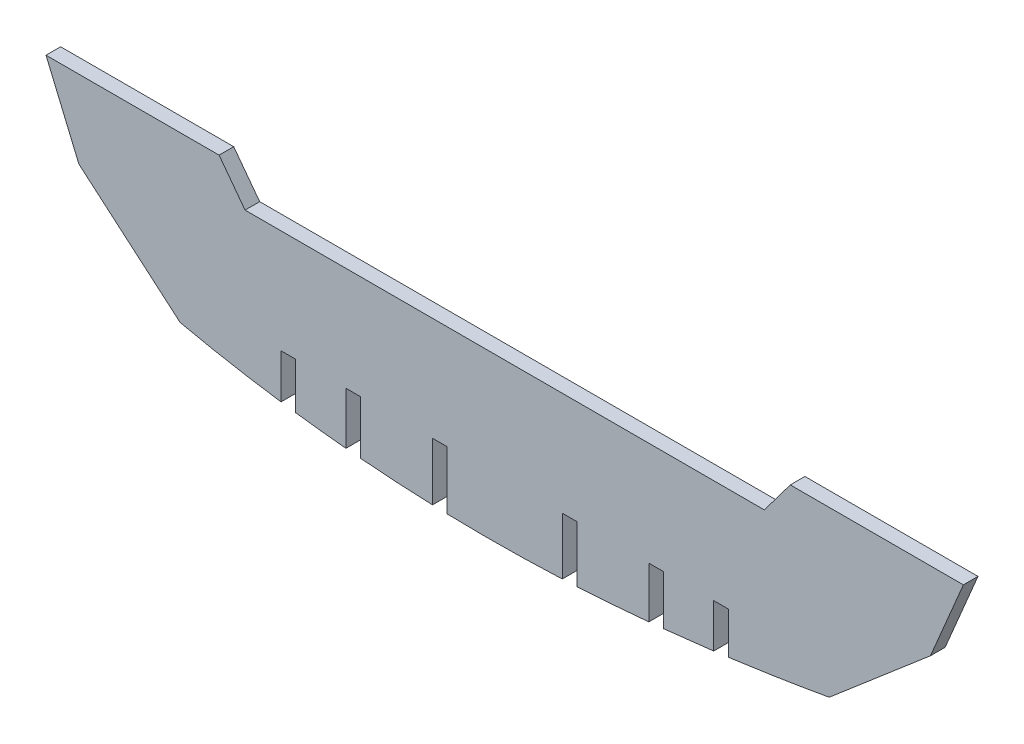
from build123d import *

# Parameters (mm, degrees)
SKETCH1_W           = 152.4
SKETCH1_H           = 38.1
BOSS_EXTRUDE1_DEPTH = 4.2926
SKETCH3_W           = 4.2926
SKETCH3_H           = 20.32
CUT_EXTRUDE2_DEPTH  = 4.2926


with BuildPart() as part:
    # Sketch1 → Boss-Extrude1 (new body)
    with BuildSketch(Plane.XY):
        Polygon((-83.82, 29.21), (-134.62, 29.21), (-124.968, 6.35), (-95.25, -19.05), (-76.2, -19.05), (-76.2, 19.05), align=None)
        Rectangle(SKETCH1_W, SKETCH1_H)
        with BuildLine():
            Line((-76.2, -19.05), (-95.25, -19.05))
            add(Edge.make_bspline(
                [(-95.25, -19.05), (-66.079235011, -25.514680938), (-2.12159074, -32.083739423), (61.761861898, -25.010246771), (95.25, -19.05)],
                knots=[0, 0, 0, 0, 0.467198678, 1, 1, 1, 1], degree=3))
            Line((95.25, -19.05), (76.2, -19.05))
            Line((76.2, -19.05), (-76.2, -19.05))
        make_face()
        Polygon((95.25, -19.05), (76.2, -19.05), (76.2, 19.05), (83.82, 29.21), (134.62, 29.21), (124.968, 6.35), align=None)
    extrude(amount=BOSS_EXTRUDE1_DEPTH)

    # Sketch3 → Cut-Extrude2 (cut)
    with BuildSketch(Plane.XY.offset(4.2926)):
        with Locations((-63.5, -21.59)):
            Rectangle(SKETCH3_W, SKETCH3_H)
        with Locations((-44.45, -21.59)):
            Rectangle(SKETCH3_W, SKETCH3_H)
        with Locations((-19.05, -21.59)):
            Rectangle(SKETCH3_W, SKETCH3_H)
        with Locations((44.45, -21.59)):
            Rectangle(SKETCH3_W, SKETCH3_H)
        with Locations((63.5, -21.59)):
            Rectangle(SKETCH3_W, SKETCH3_H)
        with Locations((19.05, -21.59)):
            Rectangle(SKETCH3_W, SKETCH3_H)
    extrude(amount=-CUT_EXTRUDE2_DEPTH, mode=Mode.SUBTRACT)


solid = part.part
